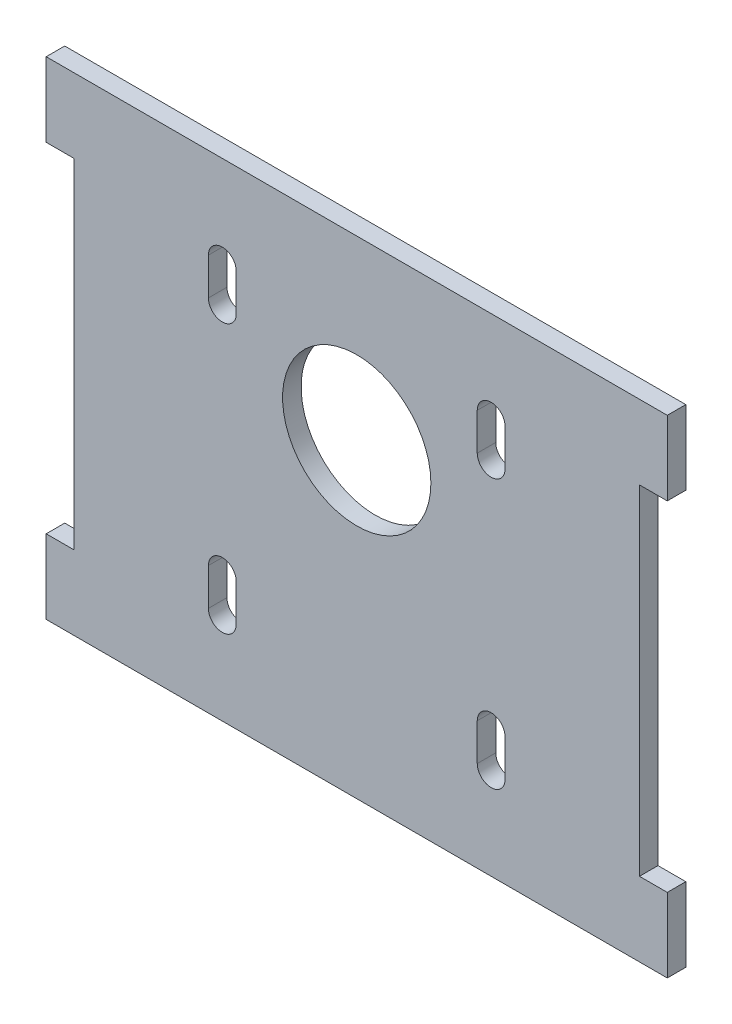
from build123d import *

# Parameters (mm, degrees)
SKETCH2_W          = 212.725
SKETCH2_H          = 166.909166922
EXTRUDE1_DEPTH     = 6.35
CUT_EXTRUDE1_REACH = 152.519
SKETCH3_R          = 25.4
CUT_EXTRUDE2_REACH = 152.519
SKETCH4_W          = 9.525
SKETCH4_H          = 116.109166922


with BuildPart() as part:
    # Sketch2 → Extrude1 (new body)
    with BuildSketch(Plane.XY):
        with Locations((0, -22.86)):
            Rectangle(SKETCH2_W, SKETCH2_H)
    extrude(amount=EXTRUDE1_DEPTH)

    # Sketch3 → Cut-Extrude1 (cut, up to next)
    with BuildSketch(Plane.XY.offset(6.35), mode=Mode.PRIVATE) as cut_extrude1_sk1:
        Circle(SKETCH3_R)
    cut_extrude1_tool1 = extrude(cut_extrude1_sk1.sketch, amount=-CUT_EXTRUDE1_REACH, mode=Mode.PRIVATE) & part.part
    # Sketch3 → Cut-Extrude1 (cut, up to next)
    with BuildSketch(Plane.XY.offset(6.35), mode=Mode.PRIVATE) as cut_extrude1_sk2:
        with BuildLine():
            Line((50.8, -75.2475), (50.8, -62.5475))
            ThreePointArc((50.8, -62.5475), (46.0375, -57.785), (41.275, -62.5475))
            Line((41.275, -62.5475), (41.275, -75.2475))
            ThreePointArc((41.275, -75.2475), (46.0375, -80.01), (50.8, -75.2475))
        make_face()
    cut_extrude1_tool2 = extrude(cut_extrude1_sk2.sketch, amount=-CUT_EXTRUDE1_REACH, mode=Mode.PRIVATE) & part.part
    # Sketch3 → Cut-Extrude1 (cut, up to next)
    with BuildSketch(Plane.XY.offset(6.35), mode=Mode.PRIVATE) as cut_extrude1_sk3:
        with BuildLine():
            Line((50.8, 16.8275), (50.8, 29.5275))
            ThreePointArc((50.8, 29.5275), (46.0375, 34.29), (41.275, 29.5275))
            Line((41.275, 29.5275), (41.275, 16.8275))
            ThreePointArc((41.275, 16.8275), (46.0375, 12.065), (50.8, 16.8275))
        make_face()
    cut_extrude1_tool3 = extrude(cut_extrude1_sk3.sketch, amount=-CUT_EXTRUDE1_REACH, mode=Mode.PRIVATE) & part.part
    # Sketch3 → Cut-Extrude1 (cut, up to next)
    with BuildSketch(Plane.XY.offset(6.35), mode=Mode.PRIVATE) as cut_extrude1_sk4:
        with BuildLine():
            Line((-41.275, 16.8275), (-41.275, 29.5275))
            ThreePointArc((-41.275, 29.5275), (-46.0375, 34.29), (-50.8, 29.5275))
            Line((-50.8, 29.5275), (-50.8, 16.8275))
            ThreePointArc((-50.8, 16.8275), (-46.0375, 12.065), (-41.275, 16.8275))
        make_face()
    cut_extrude1_tool4 = extrude(cut_extrude1_sk4.sketch, amount=-CUT_EXTRUDE1_REACH, mode=Mode.PRIVATE) & part.part
    # Sketch3 → Cut-Extrude1 (cut, up to next)
    with BuildSketch(Plane.XY.offset(6.35), mode=Mode.PRIVATE) as cut_extrude1_sk5:
        with BuildLine():
            Line((-41.275, -75.2475), (-41.275, -62.5475))
            ThreePointArc((-41.275, -62.5475), (-46.0375, -57.785), (-50.8, -62.5475))
            Line((-50.8, -62.5475), (-50.8, -75.2475))
            ThreePointArc((-50.8, -75.2475), (-46.0375, -80.01), (-41.275, -75.2475))
        make_face()
    cut_extrude1_tool5 = extrude(cut_extrude1_sk5.sketch, amount=-CUT_EXTRUDE1_REACH, mode=Mode.PRIVATE) & part.part
    add(cut_extrude1_tool1.solids().sort_by_distance((0, 0, 6.35))[0], mode=Mode.SUBTRACT)
    add(cut_extrude1_tool2.solids().sort_by_distance((46.0375, -68.8975, 6.35))[0], mode=Mode.SUBTRACT)
    add(cut_extrude1_tool3.solids().sort_by_distance((46.0375, 23.1775, 6.35))[0], mode=Mode.SUBTRACT)
    add(cut_extrude1_tool4.solids().sort_by_distance((-46.0375, 23.1775, 6.35))[0], mode=Mode.SUBTRACT)
    add(cut_extrude1_tool5.solids().sort_by_distance((-46.0375, -68.8975, 6.35))[0], mode=Mode.SUBTRACT)

    # Sketch4 → Cut-Extrude2 (cut, up to next)
    with BuildSketch(Plane.XY.offset(6.35), mode=Mode.PRIVATE) as cut_extrude2_sk1:
        with Locations((-101.6, -22.86)):
            Rectangle(SKETCH4_W, SKETCH4_H)
    cut_extrude2_tool1 = extrude(cut_extrude2_sk1.sketch, amount=-CUT_EXTRUDE2_REACH, mode=Mode.PRIVATE) & part.part
    # Sketch4 → Cut-Extrude2 (cut, up to next)
    with BuildSketch(Plane.XY.offset(6.35), mode=Mode.PRIVATE) as cut_extrude2_sk2:
        with Locations((101.6, -22.86)):
            Rectangle(SKETCH4_W, SKETCH4_H)
    cut_extrude2_tool2 = extrude(cut_extrude2_sk2.sketch, amount=-CUT_EXTRUDE2_REACH, mode=Mode.PRIVATE) & part.part
    add(cut_extrude2_tool1.solids().sort_by_distance((-101.6, -22.86, 6.35))[0], mode=Mode.SUBTRACT)
    add(cut_extrude2_tool2.solids().sort_by_distance((101.6, -22.86, 6.35))[0], mode=Mode.SUBTRACT)


solid = part.part
